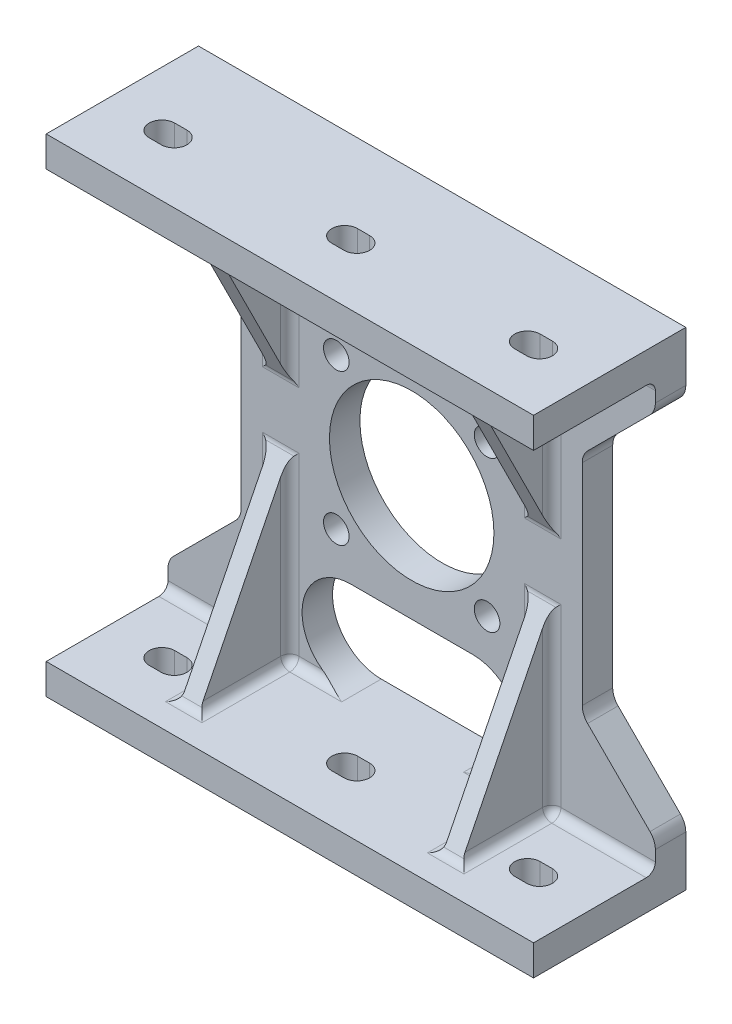
from build123d import *

# Parameters (mm, degrees)
SKETCH_1_W               = 80
SKETCH_1_H               = 80
SKETCH_1_R               = 13.5
EXTRUDE_1_DEPTH          = 5
SKETCH_2_R               = 2.1
CUT_EXTRUDE_1_DEPTH      = 5
SKETCH_3_W               = 80
SKETCH_3_H               = 20
EXTRUDE_2_DEPTH          = 5
CUT_EXTRUDE_2_DEPTH      = 5
FILLET_1_R               = 1.5
FILLET_1_OF_MIRROR_1_R   = 1.5
EXTRUDE_3_DEPTH          = 3
FILLET_2_R               = 1.5
FILLET_2_OF_MIRROR_2_R   = 1.5
CUT_EXTRUDE_3_DEPTH      = 10
FILLET_3_R               = 3
CUT_EXTRUDE_4_DEPTH      = 10
CUT_EXTRUDE_4_DEPTH_BACK = 10


with BuildPart() as part:
    # 草图1 → 凸台-拉伸1 (new body)
    with BuildSketch(Plane.XY):
        Rectangle(SKETCH_1_W, SKETCH_1_H)
        Circle(SKETCH_1_R, mode=Mode.SUBTRACT)
    extrude(amount=EXTRUDE_1_DEPTH)

    # 草图2 → 切除-拉伸1 (cut)
    with BuildSketch(Plane.XY.offset(5)):
        with Locations((-12.374368671, 12.374368671)):
            Circle(SKETCH_2_R)
        with Locations((12.374368671, 12.374368671)):
            Circle(SKETCH_2_R)
        with Locations((-12.374368671, -12.374368671)):
            Circle(SKETCH_2_R)
        with Locations((12.374368671, -12.374368671)):
            Circle(SKETCH_2_R)
    extrude(amount=-CUT_EXTRUDE_1_DEPTH, mode=Mode.SUBTRACT)

    # 草图3 → 凸台-拉伸2 (add)
    with BuildSketch(Plane(origin=(0, 40, 0), x_dir=(1, 0, 0), z_dir=(0, 1, 0))):
        with Locations((0, -15)):
            Rectangle(SKETCH_3_W, SKETCH_3_H)
    extrude_2 = extrude(amount=-EXTRUDE_2_DEPTH)

    # 草图4 → 切除-拉伸2 (cut)
    with BuildSketch(Plane(origin=(0, 40, 0), x_dir=(1, 0, 0), z_dir=(0, 1, 0))):
        with BuildLine():
            Line((-31, -12.9), (-29, -12.9))
            ThreePointArc((-29, -12.9), (-26.9, -15), (-29, -17.1))
            Line((-29, -17.1), (-31, -17.1))
            ThreePointArc((-31, -17.1), (-33.1, -15), (-31, -12.9))
        make_face()
        with BuildLine():
            Line((-1, -12.9), (1, -12.9))
            ThreePointArc((1, -12.9), (3.1, -15), (1, -17.1))
            Line((1, -17.1), (-1, -17.1))
            ThreePointArc((-1, -17.1), (-3.1, -15), (-1, -12.9))
        make_face()
        with BuildLine():
            Line((29, -12.9), (31, -12.9))
            ThreePointArc((31, -12.9), (33.1, -15), (31, -17.1))
            Line((31, -17.1), (29, -17.1))
            ThreePointArc((29, -17.1), (26.9, -15), (29, -12.9))
        make_face()
    cut_extrude_2 = extrude(amount=-CUT_EXTRUDE_2_DEPTH, mode=Mode.SUBTRACT)

    # 圆角1
    fillet_1_edges = [part.edges().sort_by_distance(p)[0] for p in [
        (0, 35, 5),
    ]]
    fillet(fillet_1_edges, radius=FILLET_1_R)

    # 镜向1: 凸台-拉伸2, 切除-拉伸2 across plane
    add(extrude_2.mirror(Plane.ZX))
    add(cut_extrude_2.mirror(Plane.ZX), mode=Mode.SUBTRACT)

    # 圆角1 of 镜向1
    fillet_1_of_mirror_1_edges = [part.edges().sort_by_distance(p)[0] for p in [
        (0, -35, 5),
    ]]
    fillet(fillet_1_of_mirror_1_edges, radius=FILLET_1_OF_MIRROR_1_R)

    # 草图5 → 凸台-拉伸3 (add)
    with BuildSketch(Plane.ZY.offset(20)):
        Polygon((20, 35), (5, 5), (5, 35), align=None)
        Polygon((20, -35), (5, -5), (5, -35), align=None)
    extrude_3 = extrude(amount=EXTRUDE_3_DEPTH)

    # 圆角2
    fillet_2_edges = [part.edges().sort_by_distance(p)[0] for p in [
        (-20, 34.560660172, 5.439339828),
        (-23, 34.560660172, 5.439339828),
        (-20, 35, 13.25),
        (-21.5, 35, 20),
        (-23, 19.25, 5),
        (-23, 35, 13.25),
        (-20, 19.25, 5),
        (-21.5, 5, 5),
        (-20, -34.560660172, 5.439339828),
        (-23, -34.560660172, 5.439339828),
        (-20, -19.25, 5),
        (-21.5, -5, 5),
        (-23, -19.25, 5),
        (-23, -35, 13.25),
        (-20, -35, 13.25),
        (-21.5, -35, 20),
    ]]
    fillet(fillet_2_edges, radius=FILLET_2_R)

    # 镜向2: 凸台-拉伸3 across plane
    add(extrude_3.mirror(Plane(origin=(0, 0, 0), x_dir=(0, 0, 1), z_dir=(1, 0, 0))))

    # 圆角2 of 镜向2
    fillet_2_of_mirror_2_edges = [part.edges().sort_by_distance(p)[0] for p in [
        (20, 34.560660172, 5.439339828),
        (23, 34.560660172, 5.439339828),
        (20, 35, 13.25),
        (21.5, 35, 20),
        (23, 19.25, 5),
        (23, 35, 13.25),
        (20, 19.25, 5),
        (21.5, 5, 5),
        (20, -34.560660172, 5.439339828),
        (23, -34.560660172, 5.439339828),
        (20, -19.25, 5),
        (21.5, -5, 5),
        (23, -19.25, 5),
        (23, -35, 13.25),
        (20, -35, 13.25),
        (21.5, -35, 20),
    ]]
    fillet(fillet_2_of_mirror_2_edges, radius=FILLET_2_OF_MIRROR_2_R)

    # 草图6 → 切除-拉伸3 (cut)
    with BuildSketch(Plane.XY.offset(5)):
        with BuildLine():
            Line((-40, 30.5), (-28.878679656, 19.378679656))
            ThreePointArc((-28.878679656, 19.378679656), (-28.228361402, 18.40540961), (-28, 17.257359313))
            Line((-28, 17.257359313), (-28, -17.257359313))
            ThreePointArc((-28, -17.257359313), (-28.228361402, -18.40540961), (-28.878679656, -19.378679656))
            Line((-28.878679656, -19.378679656), (-40, -30.5))
            Line((-40, -30.5), (-40, 30.5))
        make_face()
        with BuildLine():
            Line((40, -30.5), (40, 30.5))
            Line((40, 30.5), (28.878679656, 19.378679656))
            ThreePointArc((28.878679656, 19.378679656), (28.228361402, 18.40540961), (28, 17.257359313))
            Line((28, 17.257359313), (28, -17.257359313))
            ThreePointArc((28, -17.257359313), (28.228361402, -18.40540961), (28.878679656, -19.378679656))
            Line((28.878679656, -19.378679656), (40, -30.5))
        make_face()
    extrude(amount=-CUT_EXTRUDE_3_DEPTH, mode=Mode.SUBTRACT)

    # 圆角3
    fillet_3_edges = [part.edges().sort_by_distance(p)[0] for p in [
        (-40, -30.5, 2.5),
        (-40, 30.5, 2.5),
        (40, 30.5, 2.5),
        (40, -30.5, 2.5),
    ]]
    fillet(fillet_3_edges, radius=FILLET_3_R)

    # 草图7 → 切除-拉伸4 (cut, two sides: drawn at the far end of the back side and taken through both)
    with BuildSketch(Plane.XY.offset(5).offset(-CUT_EXTRUDE_4_DEPTH_BACK)):
        with BuildLine():
            Line((-10, 35), (10, 35))
            ThreePointArc((10, 35), (18, 27), (10, 19))
            Line((10, 19), (-10, 19))
            ThreePointArc((-10, 19), (-18, 27), (-10, 35))
        make_face()
        with BuildLine():
            Line((-10, -19), (10, -19))
            ThreePointArc((10, -19), (18, -27), (10, -35))
            Line((10, -35), (-10, -35))
            ThreePointArc((-10, -35), (-18, -27), (-10, -19))
        make_face()
    extrude(amount=CUT_EXTRUDE_4_DEPTH + CUT_EXTRUDE_4_DEPTH_BACK, mode=Mode.SUBTRACT)


solid = part.part
